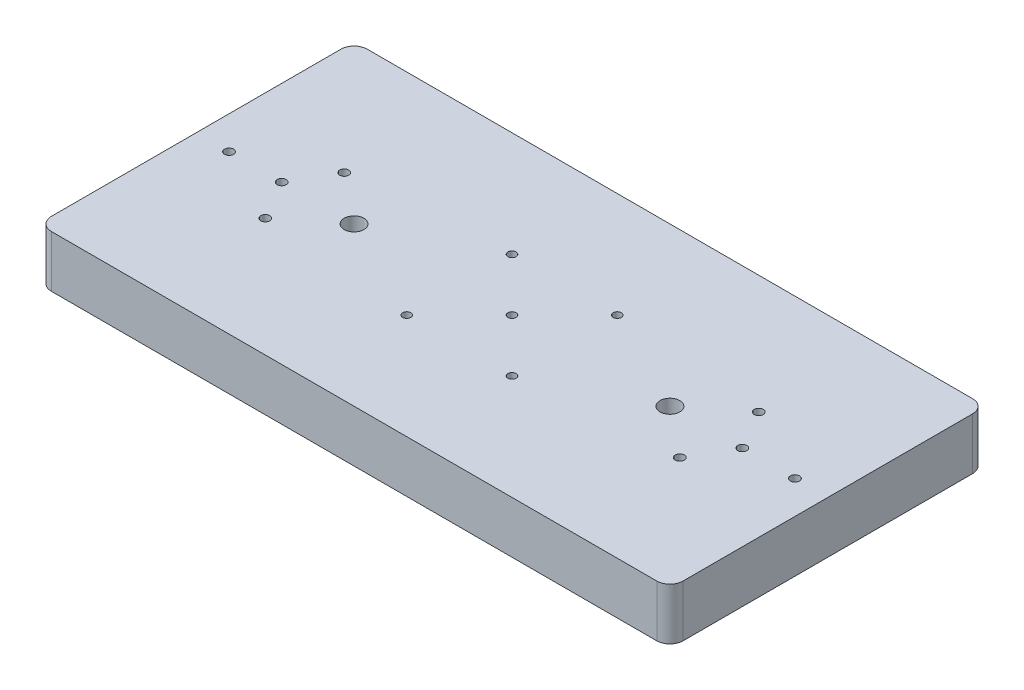
from build123d import *

# Parameters (mm, degrees)
SKETCH1_W                                         = 609.6
SKETCH1_H                                         = 304.8
EXTRUDE1_DEPTH                                    = 50.00625
FILLET1_R                                         = 12.7
SKETCH2_R                                         = 9.525
CUT_EXTRUDE1_DEPTH                                = 345.426225829
CBORE_FOR_5_16_SOCKET_HEAD_CAP_SCREW1_D           = 8.72998
CBORE_FOR_5_16_SOCKET_HEAD_CAP_SCREW1_CBORE_D     = 13.49502
CBORE_FOR_5_16_SOCKET_HEAD_CAP_SCREW1_CBORE_DEPTH = 8.6995
F_3_8_16_TAPPED_HOLE1_D                           = 7.9375
F_3_8_16_TAPPED_HOLE1_DEPTH                       = 26.9875
F_3_8_16_TAPPED_HOLE1_TIP                         = 2.384665582


with BuildPart() as part:
    # Sketch1 → Extrude1 (new body)
    with BuildSketch(Plane(origin=(0, 0, 0), x_dir=(1, 0, 0), z_dir=(0, 1, 0))):
        Rectangle(SKETCH1_W, SKETCH1_H)
    extrude(amount=EXTRUDE1_DEPTH)

    # Fillet1
    fillet1_edges = [part.edges().sort_by_distance(p)[0] for p in [
        (-304.8, 25.003125, -152.4),
        (304.8, 25.003125, -152.4),
        (304.8, 25.003125, 152.4),
        (-304.8, 25.003125, 152.4),
    ]]
    fillet(fillet1_edges, radius=FILLET1_R)

    # Sketch2 → Cut-Extrude1 (cut, through all)
    with BuildSketch(Plane(origin=(0, 50.00625, 0), x_dir=(-1, 0, 0), z_dir=(0, 1, 0))):
        with Locations(Location((152.4, 0, 0), (0, 0, 90))):
            Circle(SKETCH2_R)
        with Locations(Location((-152.4, 0, 0), (0, 0, 90))):
            Circle(SKETCH2_R)
    extrude(amount=-CUT_EXTRUDE1_DEPTH, mode=Mode.SUBTRACT)

    # CBORE for 5/16 Socket Head Cap Screw1 (through all)
    with Locations(Plane.XZ):
        with Locations((-200.025, 38.1), (-200.025, -38.1), (200.025, -38.1), (200.025, 38.1), (-222.25, 0), (-273.05, 0), (222.25, 0), (273.05, 0)):
            CounterBoreHole(CBORE_FOR_5_16_SOCKET_HEAD_CAP_SCREW1_D / 2, CBORE_FOR_5_16_SOCKET_HEAD_CAP_SCREW1_CBORE_D / 2, CBORE_FOR_5_16_SOCKET_HEAD_CAP_SCREW1_CBORE_DEPTH)

    # 3/8-16 Tapped Hole1
    with Locations(Plane(origin=(0, 50.00625, 0), x_dir=(-1, 0, 0), z_dir=(0, 1, 0))):
        with Locations((50.8, 50.8), (50.8, -50.8), (-50.8, -50.8), (-50.8, 50.8), (0, 0)):
            Hole(F_3_8_16_TAPPED_HOLE1_D / 2, depth=F_3_8_16_TAPPED_HOLE1_DEPTH)
            with Locations((0, 0, -(F_3_8_16_TAPPED_HOLE1_DEPTH + F_3_8_16_TAPPED_HOLE1_TIP / 2))):  # 118° drill point
                Cone(0, F_3_8_16_TAPPED_HOLE1_D / 2, F_3_8_16_TAPPED_HOLE1_TIP, mode=Mode.SUBTRACT)


solid = part.part
